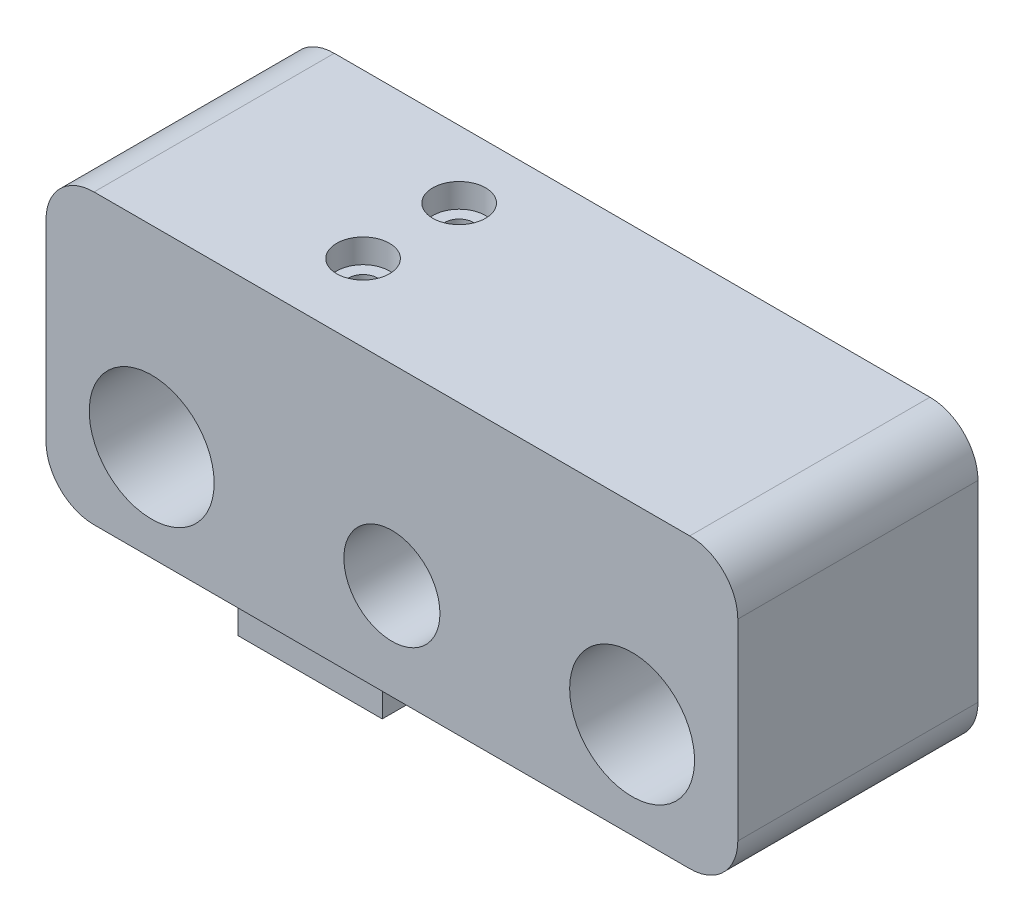
from build123d import *

# Parameters (mm, degrees)
SKETCH1_W           = 144
SKETCH1_H           = 80
BOSS_EXTRUDE1_DEPTH = 50
CUT_EXTRUDE1_REACH  = 98.354
SKETCH2_R           = 10
SKETCH2_R_2         = 13
CUT_EXTRUDE3_REACH  = 98.354
SKETCH3_W           = 144
SKETCH3_H           = 20
SKETCH5_R           = 3
CUT_EXTRUDE4_DEPTH  = 100
FILLET1_R           = 10
FILLET2_R           = 10
FILLET3_R           = 10
FILLET4_R           = 10
SKETCH6_R           = 5.5
CUT_EXTRUDE5_DEPTH  = 5
SKETCH7_W           = 30
SKETCH7_H           = 40
BOSS_EXTRUDE2_DEPTH = 10
CUT_EXTRUDE7_REACH  = 108.226
SKETCH8_R           = 3


with BuildPart() as part:
    # Sketch1 → Boss-Extrude1 (new body)
    with BuildSketch(Plane.XY):
        Rectangle(SKETCH1_W, SKETCH1_H)
    extrude(amount=BOSS_EXTRUDE1_DEPTH)

    # Sketch2 → Cut-Extrude1 (cut, up to next)
    with BuildSketch(Plane.XY.offset(50), mode=Mode.PRIVATE) as cut_extrude1_sk1:
        Circle(SKETCH2_R)
    cut_extrude1_tool1 = extrude(cut_extrude1_sk1.sketch, amount=-CUT_EXTRUDE1_REACH, mode=Mode.PRIVATE) & part.part
    # Sketch2 → Cut-Extrude1 (cut, up to next)
    with BuildSketch(Plane.XY.offset(50), mode=Mode.PRIVATE) as cut_extrude1_sk2:
        with Locations((-50, 0)):
            Circle(SKETCH2_R_2)
    cut_extrude1_tool2 = extrude(cut_extrude1_sk2.sketch, amount=-CUT_EXTRUDE1_REACH, mode=Mode.PRIVATE) & part.part
    # Sketch2 → Cut-Extrude1 (cut, up to next)
    with BuildSketch(Plane.XY.offset(50), mode=Mode.PRIVATE) as cut_extrude1_sk3:
        with Locations(Location((50, 0, 0), (0, 0, 180))):
            Circle(SKETCH2_R_2)
    cut_extrude1_tool3 = extrude(cut_extrude1_sk3.sketch, amount=-CUT_EXTRUDE1_REACH, mode=Mode.PRIVATE) & part.part
    add(cut_extrude1_tool1.solids().sort_by_distance((0, 0, 50))[0], mode=Mode.SUBTRACT)
    add(cut_extrude1_tool2.solids().sort_by_distance((-50, 0, 50))[0], mode=Mode.SUBTRACT)
    add(cut_extrude1_tool3.solids().sort_by_distance((50, 0, 50))[0], mode=Mode.SUBTRACT)

    # Sketch3 → Cut-Extrude3 (cut, up to next)
    with BuildSketch(Plane.XY.offset(50), mode=Mode.PRIVATE) as cut_extrude3_sk1:
        with Locations((0, -30)):
            Rectangle(SKETCH3_W, SKETCH3_H)
    cut_extrude3_tool1 = extrude(cut_extrude3_sk1.sketch, amount=-CUT_EXTRUDE3_REACH, mode=Mode.PRIVATE) & part.part
    add(cut_extrude3_tool1.solids().sort_by_distance((0, -30, 50))[0], mode=Mode.SUBTRACT)

    # Sketch5 → Cut-Extrude4 (cut)
    with BuildSketch(Plane.XZ.offset(20)):
        with Locations(Location((-22, 34, 0), (0, 0, 270))):
            Circle(SKETCH5_R)
        with Locations(Location((-22, 14, 0), (0, 0, 270))):
            Circle(SKETCH5_R)
    extrude(amount=-CUT_EXTRUDE4_DEPTH, mode=Mode.SUBTRACT)

    # Fillet1
    fillet1_edges = [part.edges().sort_by_distance(p)[0] for p in [
        (72, -20, 25),
    ]]
    fillet(fillet1_edges, radius=FILLET1_R)

    # Fillet2
    fillet2_edges = [part.edges().sort_by_distance(p)[0] for p in [
        (72, 40, 25),
    ]]
    fillet(fillet2_edges, radius=FILLET2_R)

    # Fillet3
    fillet3_edges = [part.edges().sort_by_distance(p)[0] for p in [
        (-72, 40, 25),
    ]]
    fillet(fillet3_edges, radius=FILLET3_R)

    # Fillet4
    fillet4_edges = [part.edges().sort_by_distance(p)[0] for p in [
        (-72, -20, 25),
    ]]
    fillet(fillet4_edges, radius=FILLET4_R)

    # Sketch6 → Cut-Extrude5 (cut)
    with BuildSketch(Plane(origin=(0, 40, 0), x_dir=(1, 0, 0), z_dir=(0, 1, 0))):
        with Locations(Location((-22, -14, 0), (0, 0, 270))):
            Circle(SKETCH6_R)
        with Locations(Location((-22, -34, 0), (0, 0, 270))):
            Circle(SKETCH6_R)
    extrude(amount=-CUT_EXTRUDE5_DEPTH, mode=Mode.SUBTRACT)

    # Sketch7 → Boss-Extrude2 (add)
    with BuildSketch(Plane.XZ.offset(20)):
        with Locations((-22, 25)):
            Rectangle(SKETCH7_W, SKETCH7_H)
    extrude(amount=BOSS_EXTRUDE2_DEPTH)

    # Sketch8 → Cut-Extrude7 (cut, up to next)
    with BuildSketch(Plane(origin=(0, -20, 0), x_dir=(1, 0, 0), z_dir=(0, 1, 0)), mode=Mode.PRIVATE) as cut_extrude7_sk1:
        with Locations(Location((-22, -34, 0), (0, 0, 90))):
            Circle(SKETCH8_R)
    cut_extrude7_tool1 = extrude(cut_extrude7_sk1.sketch, amount=-CUT_EXTRUDE7_REACH, mode=Mode.PRIVATE) & part.part
    # Sketch8 → Cut-Extrude7 (cut, up to next)
    with BuildSketch(Plane(origin=(0, -20, 0), x_dir=(1, 0, 0), z_dir=(0, 1, 0)), mode=Mode.PRIVATE) as cut_extrude7_sk2:
        with Locations(Location((-22, -14, 0), (0, 0, 90))):
            Circle(SKETCH8_R)
    cut_extrude7_tool2 = extrude(cut_extrude7_sk2.sketch, amount=-CUT_EXTRUDE7_REACH, mode=Mode.PRIVATE) & part.part
    add(cut_extrude7_tool1.solids().sort_by_distance((-22, -20, 34))[0], mode=Mode.SUBTRACT)
    add(cut_extrude7_tool2.solids().sort_by_distance((-22, -20, 14))[0], mode=Mode.SUBTRACT)


solid = part.part
